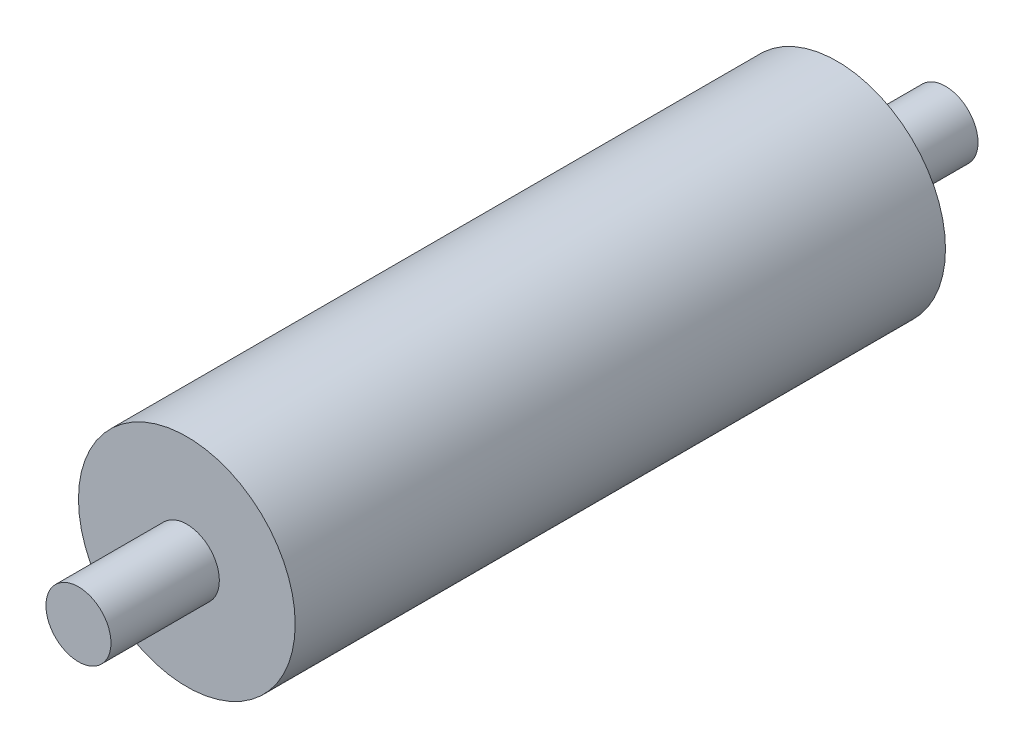
from build123d import *

# Parameters (mm, degrees)
SKETCH1_R           = 50
BOSS_EXTRUDE1_DEPTH = 300
SKETCH2_R           = 15
BOSS_EXTRUDE2_DEPTH = 50
LPATTERN1_COUNT     = 2
LPATTERN1_PITCH     = 350


with BuildPart() as part:
    # Sketch1 → Boss-Extrude1 (new body)
    with BuildSketch(Plane.XY):
        Circle(SKETCH1_R)
    extrude(amount=BOSS_EXTRUDE1_DEPTH)

    # Sketch2 → Boss-Extrude2 (add)
    with BuildSketch(Plane.XY.offset(300)):
        Circle(SKETCH2_R)
    boss_extrude2 = extrude(amount=BOSS_EXTRUDE2_DEPTH)

    # LPattern1: Boss-Extrude2 ×2
    with Locations(*[(0, 0, -i * LPATTERN1_PITCH) for i in range(1, LPATTERN1_COUNT)]):
        add(boss_extrude2)


solid = part.part
